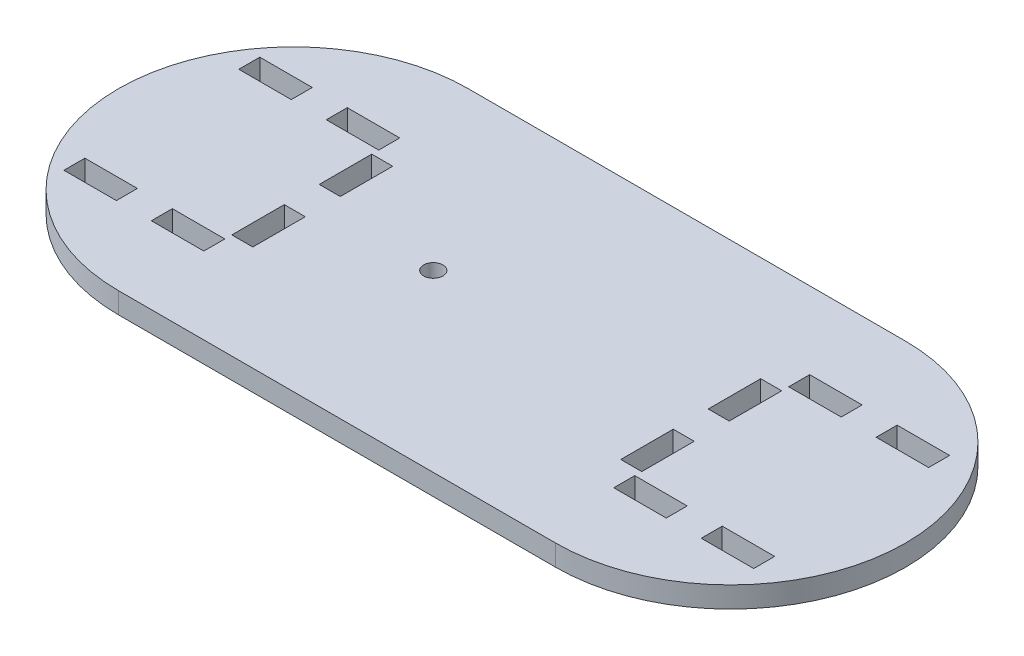
from build123d import *

# Parameters (mm, degrees)
SALIENTE_EXTRUIR1_DEPTH      = 3
TALADRO_DE_MARGEN_PARA_M51_D = 5.5
CROQUIS7_W                   = 15
CROQUIS7_H                   = 6
CROQUIS7_W_2                 = 6
CROQUIS7_H_2                 = 15
CORTAR_EXTRUIR1_DEPTH        = 145.086779407


with BuildPart() as part:
    # Croquis1 → Saliente-Extruir1 (new, symmetric)
    with BuildSketch(Plane(origin=(0, 0, 0), x_dir=(1, 0, 0), z_dir=(0, 1, 0))):
        with BuildLine():
            Line((-40, 50), (85, 50))
            ThreePointArc((85, 50), (135, 0), (85, -50))
            Line((85, -50), (-40, -50))
            ThreePointArc((-40, -50), (-90, 0), (-40, 50))
        make_face()
    extrude(amount=SALIENTE_EXTRUIR1_DEPTH, both=True)

    # Taladro de margen para M51 (through all)
    with Locations(Plane(origin=(0, 3, 0), x_dir=(1, 0, 0), z_dir=(0, 1, 0))):
        with Locations((0, 0)):
            Hole(TALADRO_DE_MARGEN_PARA_M51_D / 2)

    # Croquis7 → Cortar-Extruir1 (cut, through all)
    with BuildSketch(Plane(origin=(0, -3, 0), x_dir=(-1, 0, 0), z_dir=(0, -1, 0))):
        with Locations((-87.09375, -25)):
            Rectangle(CROQUIS7_W, CROQUIS7_H)
        with Locations((-112.09375, -25)):
            Rectangle(CROQUIS7_W, CROQUIS7_H)
        with Locations((-112.09375, 25)):
            Rectangle(CROQUIS7_W, CROQUIS7_H)
        with Locations((-87.09375, 25)):
            Rectangle(CROQUIS7_W, CROQUIS7_H)
        with Locations((-76.59375, -12.5)):
            Rectangle(CROQUIS7_W_2, CROQUIS7_H_2)
        with Locations((-76.59375, 12.5)):
            Rectangle(CROQUIS7_W_2, CROQUIS7_H_2)
    cortar_extruir1 = extrude(amount=-CORTAR_EXTRUIR1_DEPTH, mode=Mode.SUBTRACT)

    # Simetría1: Cortar-Extruir1 across plane
    add(cortar_extruir1.mirror(Plane(origin=(21, 0, 0), x_dir=(0, 0, 1), z_dir=(1, 0, 0))), mode=Mode.SUBTRACT)


solid = part.part
